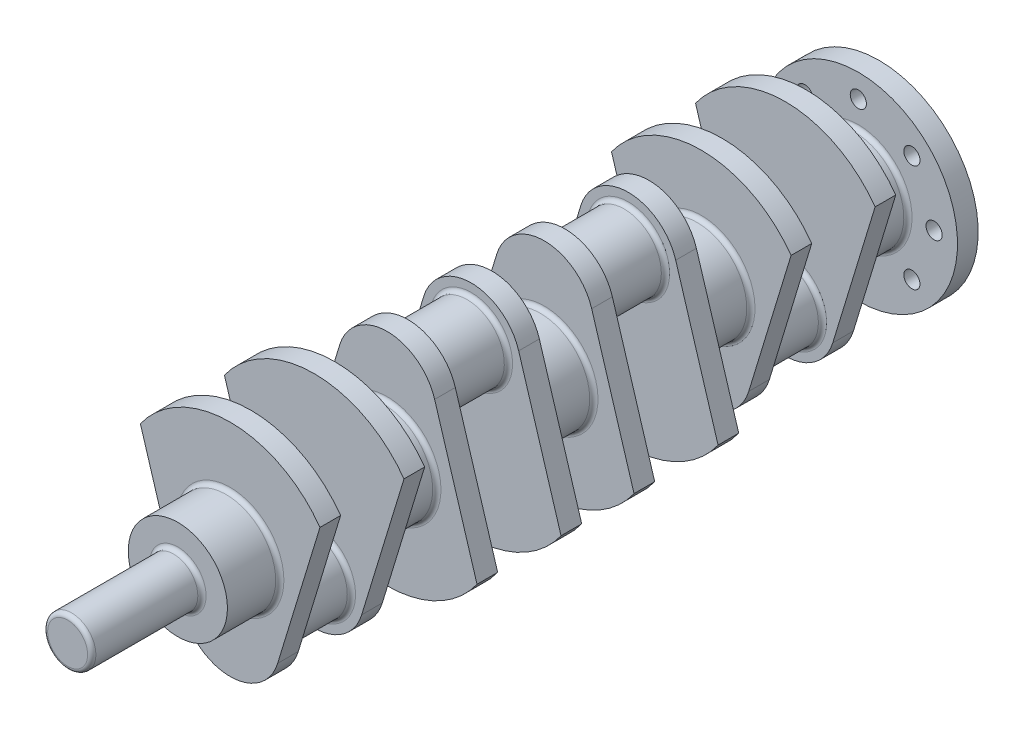
from build123d import *

# Parameters (mm, degrees)
SKETCH3_R             = 36
BOSS_EXTRUDE1_DEPTH   = 15
SKETCH4_R             = 27
BOSS_EXTRUDE2_DEPTH   = 46
SKETCH8_R             = 36
BOSS_EXTRUDE4_DEPTH   = 38
BODY_MOVE_COPY2_ANGLE = 180
SKETCH9_R             = 17.5
BOSS_EXTRUDE5_DEPTH   = 80
SKETCH10_R            = 72
SKETCH10_R_2          = 5.875664419
BOSS_EXTRUDE6_DEPTH   = 15
FILLET1_R             = 3


with BuildPart() as part:
    # Sketch3 → Boss-Extrude1 (new body)
    with BuildSketch(Plane.XY):
        with BuildLine():
            ThreePointArc((65.184364618, 56.291750003), (0, 89.912890494), (-65.184364618, 56.291750003))
            Line((-65.184364618, 56.291750003), (-34.435751244, -44.583729735))
            ThreePointArc((-34.435751244, -44.583729735), (-5.306267766, 1.519680891), (36, -34.087109506))
            ThreePointArc((36, -34.087109506), (35.606790397, -39.393377272), (34.435751244, -44.583729735))
            Line((34.435751244, -44.583729735), (65.184364618, 56.291750003))
        make_face()
        with Locations((0, -34.087109506)):
            Circle(SKETCH3_R)
    boss_extrude1 = extrude(amount=BOSS_EXTRUDE1_DEPTH)

    # Sketch4 → Boss-Extrude2 (add)
    with BuildSketch(Plane(origin=(0, 0, 0), x_dir=(-1, 0, 0), z_dir=(0, 0, -1))):
        with Locations(Location((0, -34.087109506, 0), (0, 0, 180))):
            Circle(SKETCH4_R)
    extrude(amount=BOSS_EXTRUDE2_DEPTH)

    # Sketch8 → Boss-Extrude4 (add)
    with BuildSketch(Plane.XY.offset(15)):
        with Locations((0, 9.912890494)):
            Circle(SKETCH8_R)
    boss_extrude4 = extrude(amount=BOSS_EXTRUDE4_DEPTH)

    # Mirror4: Boss-Extrude1, Boss-Extrude4 across plane
    add(boss_extrude1.mirror(Plane(origin=(0, 0, -23), x_dir=(1, 0, 0), z_dir=(0, 0, -1))))
    add(boss_extrude4.mirror(Plane(origin=(0, 0, -23), x_dir=(1, 0, 0), z_dir=(0, 0, -1))))


with BuildPart() as body_2:
    # Mirror5: mirrored copy
    add(part.part.mirror(Plane(origin=(0, 0, -80), x_dir=(1, 0, 0), z_dir=(0, 0, -1))))


with BuildPart() as body_2_1:
    # Body-Move/Copy2: moved
    add(body_2.part.rotate(Axis((0, 9.912890494, -137), (1, 0, 0)), BODY_MOVE_COPY2_ANGLE))


with BuildPart() as body_3:
    # Mirror6: mirrored copy
    add(body_2_1.part.mirror(Plane(origin=(0, 0, -194), x_dir=(1, 0, 0), z_dir=(0, 0, -1))))


with BuildPart() as body_4:
    # Mirror6 2: mirrored copy
    add(part.part.mirror(Plane(origin=(0, 0, -194), x_dir=(1, 0, 0), z_dir=(0, 0, -1))))

    # Sketch10 → Boss-Extrude6 (add)
    with BuildSketch(Plane(origin=(0, 0, -441), x_dir=(-1, 0, 0), z_dir=(0, 0, -1))):
        with Locations(Location((0, 9.912890494, 0), (0, 0, 90))):
            Circle(SKETCH10_R)
        with Locations(Location((0, 64.912890494, 0), (0, 0, 90))):
            Circle(SKETCH10_R_2, mode=Mode.SUBTRACT)
        with Locations(Location((38.890872965, 48.803763459, 0), (0, 0, 90))):
            Circle(SKETCH10_R_2, mode=Mode.SUBTRACT)
        with Locations(Location((55, 9.912890494, 0), (0, 0, 90))):
            Circle(SKETCH10_R_2, mode=Mode.SUBTRACT)
        with Locations(Location((38.890872965, -28.977982471, 0), (0, 0, 90))):
            Circle(SKETCH10_R_2, mode=Mode.SUBTRACT)
        with Locations(Location((0, -45.087109506, 0), (0, 0, 90))):
            Circle(SKETCH10_R_2, mode=Mode.SUBTRACT)
        with Locations(Location((-38.890872965, -28.977982471, 0), (0, 0, 90))):
            Circle(SKETCH10_R_2, mode=Mode.SUBTRACT)
        with Locations(Location((-55, 9.912890494, 0), (0, 0, 90))):
            Circle(SKETCH10_R_2, mode=Mode.SUBTRACT)
        with Locations(Location((-38.890872965, 48.803763459, 0), (0, 0, 90))):
            Circle(SKETCH10_R_2, mode=Mode.SUBTRACT)
    extrude(amount=BOSS_EXTRUDE6_DEPTH)


with BuildPart() as part_1:
    add(part.part)

    # Sketch9 → Boss-Extrude5 (add)
    with BuildSketch(Plane.XY.offset(53)):
        with Locations((0, 9.912890494)):
            Circle(SKETCH9_R)
    extrude(amount=BOSS_EXTRUDE5_DEPTH)

    # Combine1: union body 2, body 3, body 4
    add(body_2_1.part)
    add(body_3.part)
    add(body_4.part)

    # Fillet1
    fillet1_edges = [part_1.edges().sort_by_distance(p)[0] for p in [
        (-27, -34.087109506, 0),
        (-27, -34.087109506, -46),
        (-36, 9.912890494, 15),
        (-36, 9.912890494, -61),
        (-17.5, 9.912890494, 53),
        (-17.5, 9.912890494, 133),
        (-36, 9.912890494, -99),
        (-27, 53.912890494, -114),
        (-27, 53.912890494, -160),
        (-36, 9.912890494, -175),
        (-27, 53.912890494, -274),
        (-36, 9.912890494, -289),
        (-27, 53.912890494, -228),
        (-36, 9.912890494, -213),
        (-36, 9.912890494, -403),
        (-27, -34.087109506, -388),
        (-27, -34.087109506, -342),
        (-36, 9.912890494, -327),
        (-36, 9.912890494, -441),
    ]]
    fillet(fillet1_edges, radius=FILLET1_R)


solid = part_1.part
